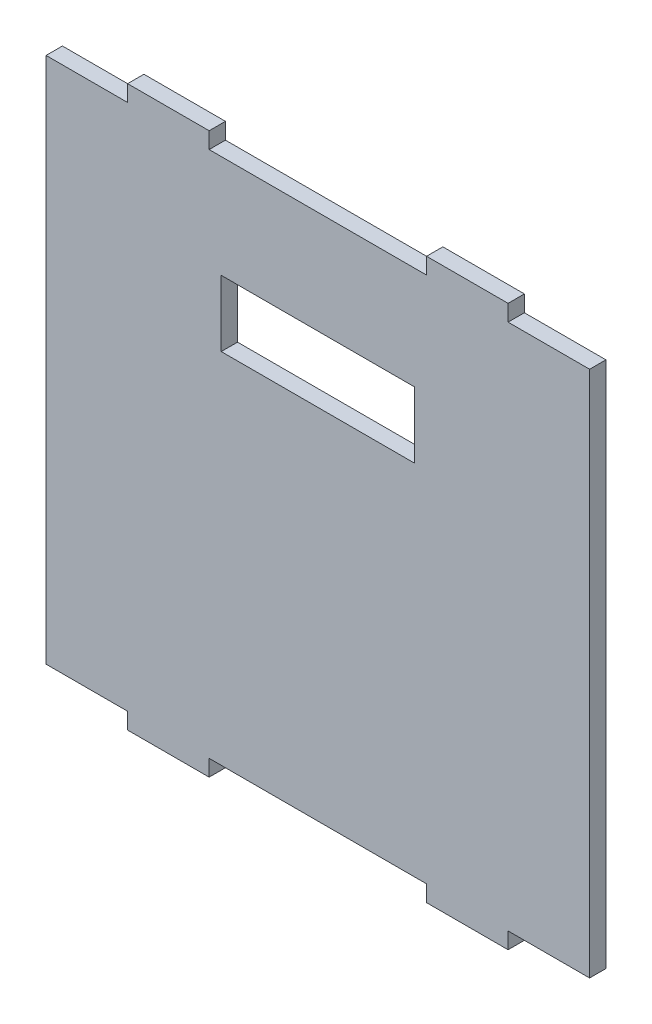
from build123d import *

# Parameters (mm, degrees)
RESSALTO_EXTRUS_O1_DEPTH = 6
ESBO_O4_W                = 71.1
ESBO_O4_H                = 24.3
CORTE_EXTRUS_O2_DEPTH    = 6


with BuildPart() as part:
    # Esboço1 → Ressalto-extrusão1 (new body)
    with BuildSketch(Plane.XY):
        Polygon((-70, -97), (-100, -97), (-100, 97), (-70, 97), (-70, 103), (-40, 103), (-40, 97), (40, 97), (40, 103), (70, 103), (70, 97), (100, 97), (100, -97), (70, -97), (70, -103), (40, -103), (40, -97), (-40, -97), (-40, -103), (-70, -103), align=None)
    extrude(amount=RESSALTO_EXTRUS_O1_DEPTH)

    # Esboço4 → Corte-extrusão2 (cut)
    with BuildSketch(Plane(origin=(0, 0, 0), x_dir=(-1, 0, 0), z_dir=(0, 0, -1))):
        with Locations((0, 47)):
            Rectangle(ESBO_O4_W, ESBO_O4_H)
    extrude(amount=-CORTE_EXTRUS_O2_DEPTH, mode=Mode.SUBTRACT)


solid = part.part
